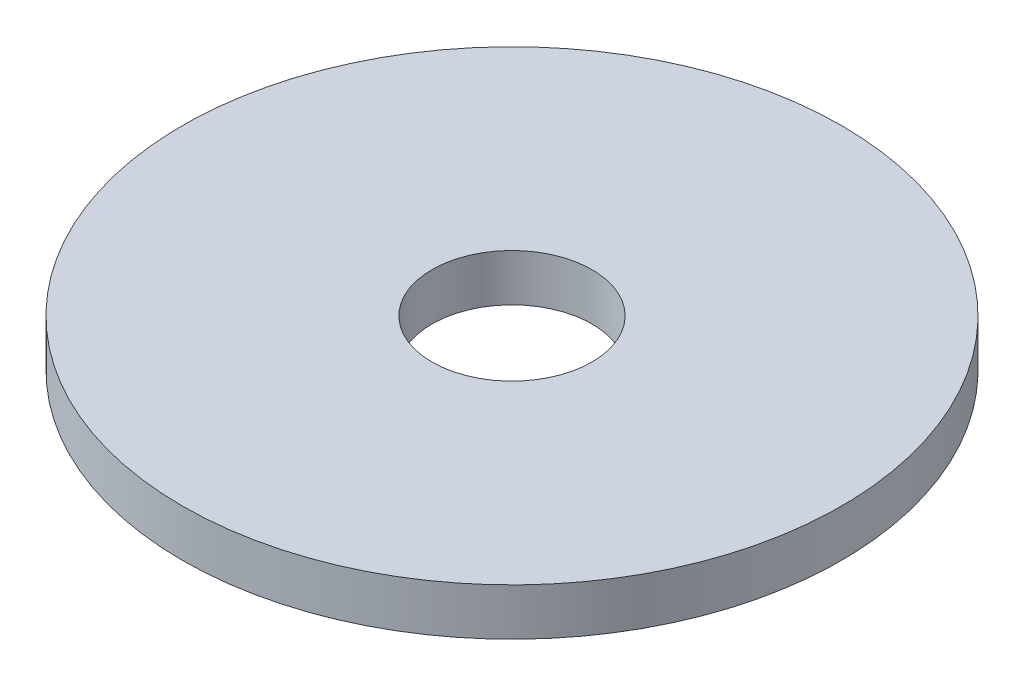
from build123d import *

# Parameters (mm, degrees)
SZKIC1_R                    = 35
SZKIC1_R_2                  = 8.5
DODANIE_WYCI_GNI_CIE1_DEPTH = 5


with BuildPart() as part:
    # Szkic1 → Dodanie-wyciągnięcie1 (new body)
    with BuildSketch(Plane(origin=(0, 0, 0), x_dir=(1, 0, 0), z_dir=(0, 1, 0))):
        with Locations(Location((0, 0, 0), (0, 0, 270))):
            Circle(SZKIC1_R)
        with Locations(Location((0, 0, 0), (0, 0, 270))):
            Circle(SZKIC1_R_2, mode=Mode.SUBTRACT)
    extrude(amount=DODANIE_WYCI_GNI_CIE1_DEPTH)


solid = part.part
